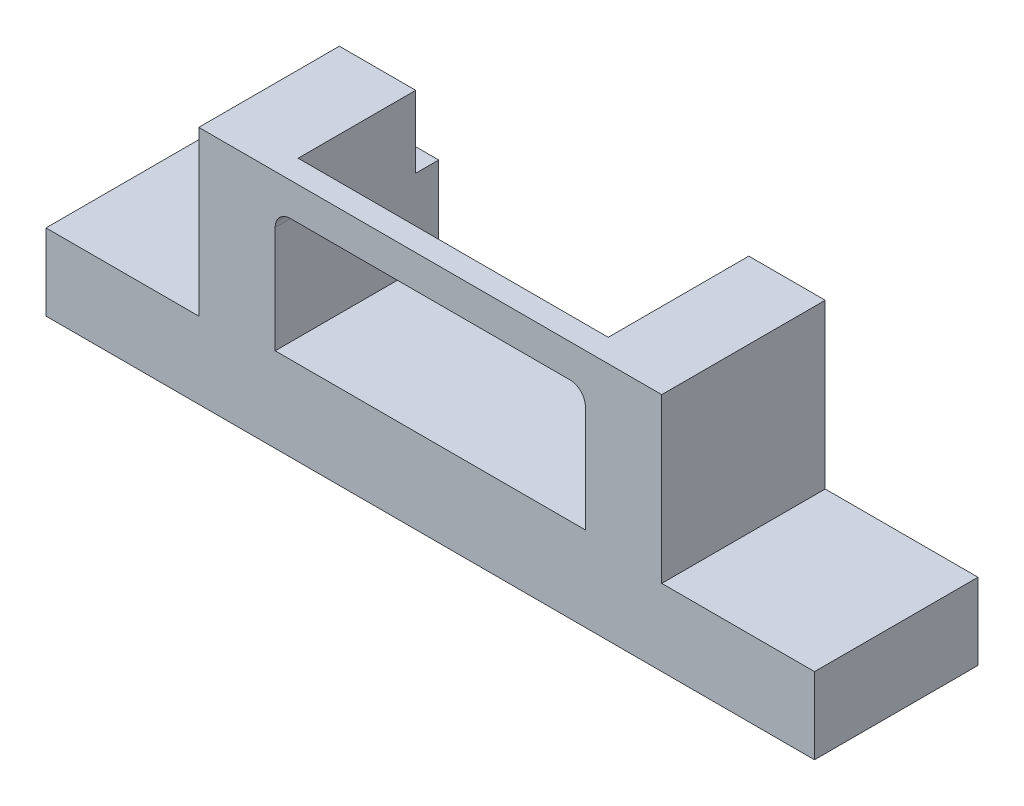
from build123d import *

# Parameters (mm, degrees)
CROQUIS1_W              = 50.3
CROQUIS1_H              = 10.7
SALIENTE_EXTRUIR1_DEPTH = 15.7
CORTAR_EXTRUIR1_REACH   = 55.769
CROQUIS2_W              = 10
CROQUIS2_H              = 10.7
CORTAR_EXTRUIR2_REACH   = 55.769
CROQUIS3_W              = 20.3
CROQUIS3_H              = 9.2
CORTAR_EXTRUIR3_REACH   = 46.554
CROQUIS4_W              = 1.5
CROQUIS4_H              = 4.7


with BuildPart() as part:
    # Croquis1 → Saliente-Extruir1 (new body)
    with BuildSketch(Plane(origin=(0, 0, 0), x_dir=(1, 0, 0), z_dir=(0, 1, 0))):
        with Locations((-25.15, -5.35)):
            Rectangle(CROQUIS1_W, CROQUIS1_H)
    extrude(amount=SALIENTE_EXTRUIR1_DEPTH)

    # Croquis2 → Cortar-Extruir1 (cut, up to next)
    with BuildSketch(Plane.XY.offset(10.7), mode=Mode.PRIVATE) as cortar_extruir1_sk1:
        with Locations((-45.3, 10.35)):
            Rectangle(CROQUIS2_W, CROQUIS2_H)
    cortar_extruir1_tool1 = extrude(cortar_extruir1_sk1.sketch, amount=-CORTAR_EXTRUIR1_REACH, mode=Mode.PRIVATE) & part.part
    # Croquis2 → Cortar-Extruir1 (cut, up to next)
    with BuildSketch(Plane.XY.offset(10.7), mode=Mode.PRIVATE) as cortar_extruir1_sk2:
        with BuildLine():
            Line((-35.3, 5.532906309), (-15, 5.532906309))
            Line((-15, 5.532906309), (-15, 12.532906309))
            ThreePointArc((-15, 12.532906309), (-15.292893219, 13.240013091), (-16, 13.532906309))
            Line((-16, 13.532906309), (-34.3, 13.532906309))
            ThreePointArc((-34.3, 13.532906309), (-35.007106781, 13.240013091), (-35.3, 12.532906309))
            Line((-35.3, 12.532906309), (-35.3, 5.532906309))
        make_face()
    cortar_extruir1_tool2 = extrude(cortar_extruir1_sk2.sketch, amount=-CORTAR_EXTRUIR1_REACH, mode=Mode.PRIVATE) & part.part
    # Croquis2 → Cortar-Extruir1 (cut, up to next)
    with BuildSketch(Plane.XY.offset(10.7), mode=Mode.PRIVATE) as cortar_extruir1_sk3:
        with Locations((-5, 10.35)):
            Rectangle(CROQUIS2_W, CROQUIS2_H)
    cortar_extruir1_tool3 = extrude(cortar_extruir1_sk3.sketch, amount=-CORTAR_EXTRUIR1_REACH, mode=Mode.PRIVATE) & part.part
    add(cortar_extruir1_tool1.solids().sort_by_distance((-45.3, 10.35, 10.7))[0], mode=Mode.SUBTRACT)
    add(cortar_extruir1_tool2.solids().sort_by_distance((-25.15, 9.522899, 10.7))[0], mode=Mode.SUBTRACT)
    add(cortar_extruir1_tool3.solids().sort_by_distance((-5, 10.35, 10.7))[0], mode=Mode.SUBTRACT)

    # Croquis3 → Cortar-Extruir2 (cut, up to next)
    with BuildSketch(Plane(origin=(0, 15.7, 0), x_dir=(1, 0, 0), z_dir=(0, 1, 0)), mode=Mode.PRIVATE) as cortar_extruir2_sk1:
        with Locations((-25.15, -4.6)):
            Rectangle(CROQUIS3_W, CROQUIS3_H)
    cortar_extruir2_tool1 = extrude(cortar_extruir2_sk1.sketch, amount=-CORTAR_EXTRUIR2_REACH, mode=Mode.PRIVATE) & part.part
    add(cortar_extruir2_tool1.solids().sort_by_distance((-25.15, 15.7, 4.6))[0], mode=Mode.SUBTRACT)

    # Croquis4 → Cortar-Extruir3 (cut, up to next)
    with BuildSketch(Plane.ZY.offset(40.3), mode=Mode.PRIVATE) as cortar_extruir3_sk1:
        with Locations((0.75, 13.35)):
            Rectangle(CROQUIS4_W, CROQUIS4_H)
    cortar_extruir3_tool1 = extrude(cortar_extruir3_sk1.sketch, amount=-CORTAR_EXTRUIR3_REACH, mode=Mode.PRIVATE) & part.part
    add(cortar_extruir3_tool1.solids().sort_by_distance((-40.3, 13.35, 0.75))[0], mode=Mode.SUBTRACT)


solid = part.part
